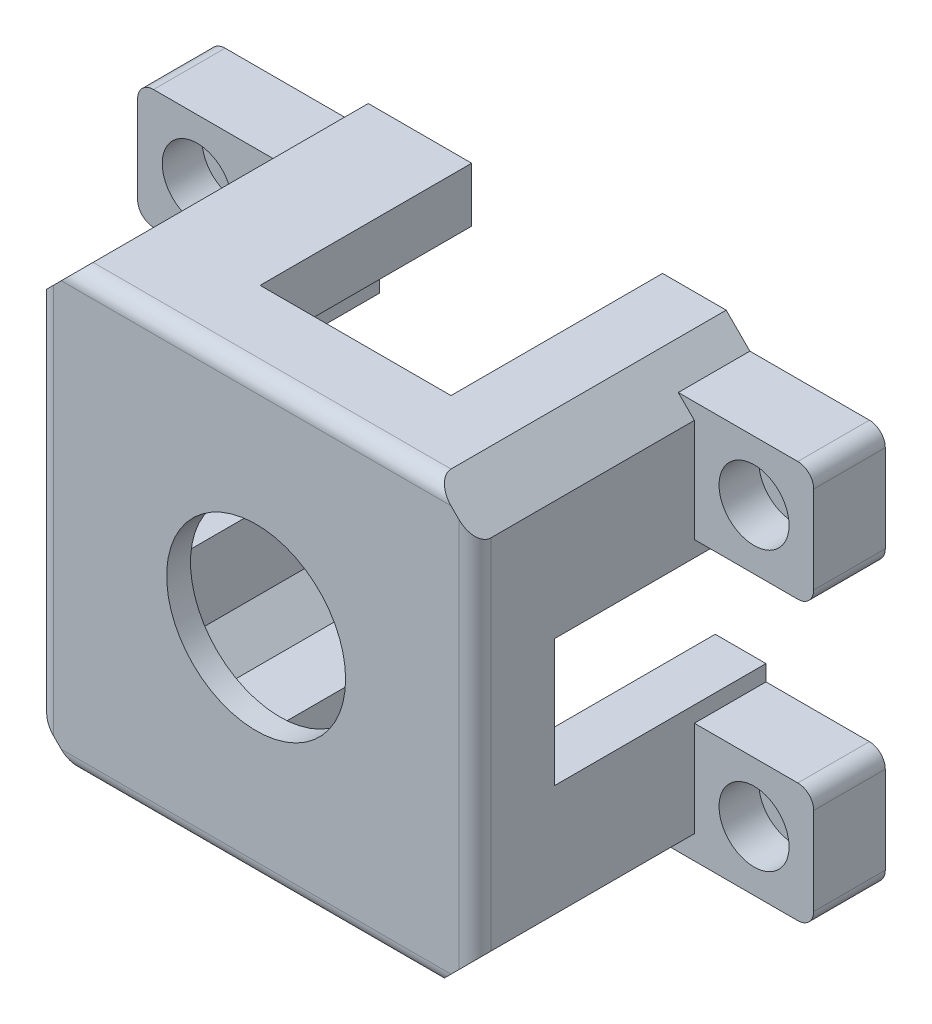
from build123d import *

# Parameters (mm, degrees)
SKETCH2_W           = 55
SKETCH2_H           = 55
BOSS_EXTRUDE1_DEPTH = 33.6
BOSS_EXTRUDE2_DEPTH = 3
SKETCH4_W           = 15
SKETCH4_H           = 15
SKETCH4_R           = 2.6
BOSS_EXTRUDE3_DEPTH = 9
CUT_EXTRUDE1_START  = -5
SKETCH6_R           = 4.4
SKETCH6_R_2         = 2.6
CUT_EXTRUDE1_DEPTH  = 5
CHAMFER1_SIZE       = 5
FILLET4_R           = 2
SKETCH7_W           = 24
SKETCH7_H           = 26.6
CUT_EXTRUDE2_DEPTH  = 67
SKETCH8_W           = 26.6
SKETCH8_H           = 16
CUT_EXTRUDE3_DEPTH  = 67


with BuildPart() as part:
    # Sketch2 → Boss-Extrude1 (new body)
    with BuildSketch(Plane.XY):
        with Locations((0, 0.476186899)):
            Rectangle(SKETCH2_W, SKETCH2_H)
        Polygon((21.118377871, -17.280631787), (21.118377871, 17.280631787), (17.280631787, 21.118377871), (-17.280631787, 21.118377871), (-21.118377871, 17.280631787), (-21.118377871, -17.280631787), (-17.280631787, -21.118377871), (17.280631787, -21.118377871), align=None, mode=Mode.SUBTRACT)
    extrude(amount=BOSS_EXTRUDE1_DEPTH)

    # Sketch3 → Boss-Extrude2 (add)
    with BuildSketch(Plane.XY.offset(33.6)):
        with BuildLine():
            Line((-7.954951288, 8.431138187), (-18.961411379, 19.437598278))
            Line((-18.961411379, 19.437598278), (-21.118377871, 17.280631787))
            Line((-21.118377871, 17.280631787), (-21.118377871, -17.280631787))
            Line((-21.118377871, -17.280631787), (-19.437598278, -18.961411379))
            Line((-19.437598278, -18.961411379), (-7.954951288, -7.478764389))
            ThreePointArc((-7.954951288, -7.478764389), (-11.25, 0.476186899), (-7.954951288, 8.431138187))
        make_face()
        with BuildLine():
            Line((-7.954951288, -7.478764389), (-19.437598278, -18.961411379))
            Line((-19.437598278, -18.961411379), (-17.280631787, -21.118377871))
            Line((-17.280631787, -21.118377871), (17.280631787, -21.118377871))
            Line((17.280631787, -21.118377871), (19.437598278, -18.961411379))
            Line((19.437598278, -18.961411379), (7.954951288, -7.478764389))
            ThreePointArc((7.954951288, -7.478764389), (0, -10.773813101), (-7.954951288, -7.478764389))
        make_face()
        with BuildLine():
            Line((21.118377871, 17.280631787), (18.961411379, 19.437598278))
            Line((18.961411379, 19.437598278), (7.954951288, 8.431138187))
            ThreePointArc((7.954951288, 8.431138187), (10.393644741, 4.781375513), (11.25, 0.476186899))
            ThreePointArc((11.25, 0.476186899), (10.393644741, -3.829001715), (7.954951288, -7.478764389))
            Line((7.954951288, -7.478764389), (19.437598278, -18.961411379))
            Line((19.437598278, -18.961411379), (21.118377871, -17.280631787))
            Line((21.118377871, -17.280631787), (21.118377871, 17.280631787))
        make_face()
        with BuildLine():
            Line((-17.280631787, 21.118377871), (-18.961411379, 19.437598278))
            Line((-18.961411379, 19.437598278), (-7.954951288, 8.431138187))
            ThreePointArc((-7.954951288, 8.431138187), (0, 11.726186899), (7.954951288, 8.431138187))
            Line((7.954951288, 8.431138187), (18.961411379, 19.437598278))
            Line((18.961411379, 19.437598278), (17.280631787, 21.118377871))
            Line((17.280631787, 21.118377871), (-17.280631787, 21.118377871))
        make_face()
        Polygon((-18.961411379, 19.437598278), (-27.5, 27.976186899), (-27.5, -27.023813101), (-19.437598278, -18.961411379), (-21.118377871, -17.280631787), (-21.118377871, 17.280631787), align=None)
        Polygon((-19.437598278, -18.961411379), (-27.5, -27.023813101), (27.5, -27.023813101), (19.437598278, -18.961411379), (17.280631787, -21.118377871), (-17.280631787, -21.118377871), align=None)
        Polygon((27.5, -27.023813101), (27.5, 27.976186899), (18.961411379, 19.437598278), (21.118377871, 17.280631787), (21.118377871, -17.280631787), (19.437598278, -18.961411379), align=None)
        Polygon((27.5, 27.976186899), (-27.5, 27.976186899), (-18.961411379, 19.437598278), (-17.280631787, 21.118377871), (17.280631787, 21.118377871), (18.961411379, 19.437598278), align=None)
    extrude(amount=BOSS_EXTRUDE2_DEPTH)

    # Sketch4 → Boss-Extrude3 (add)
    # profile 1 of 4: a face of its own
    with BuildSketch(Plane(origin=(0, 0, 0), x_dir=(-1, 0, 0), z_dir=(0, 0, -1))):
        with Locations((-35, 17.5)):
            Rectangle(SKETCH4_W, SKETCH4_H)
        with Locations((-35, 17.5)):
            Circle(SKETCH4_R, mode=Mode.SUBTRACT)
    # profile 2 of 4: a face of its own
    with BuildSketch(Plane(origin=(0, 0, 0), x_dir=(-1, 0, 0), z_dir=(0, 0, -1))):
        with Locations((35, 17.5)):
            Rectangle(SKETCH4_W, SKETCH4_H)
        with Locations((35, 17.5)):
            Circle(SKETCH4_R, mode=Mode.SUBTRACT)
    # profile 3 of 4: a face of its own
    with BuildSketch(Plane(origin=(0, 0, 0), x_dir=(-1, 0, 0), z_dir=(0, 0, -1))):
        with Locations((-35, -17.5)):
            Rectangle(SKETCH4_W, SKETCH4_H)
        with Locations((-35, -17.5)):
            Circle(SKETCH4_R, mode=Mode.SUBTRACT)
    # profile 4 of 4: a face of its own
    with BuildSketch(Plane(origin=(0, 0, 0), x_dir=(-1, 0, 0), z_dir=(0, 0, -1))):
        with Locations((17.5, -34.523813101)):
            Rectangle(SKETCH4_W, SKETCH4_H)
        with Locations((17.5, -34.523813101)):
            Circle(SKETCH4_R, mode=Mode.SUBTRACT)
    extrude(amount=-BOSS_EXTRUDE3_DEPTH)

    # Sketch6 → Cut-Extrude1 (cut)
    # profile 1 of 4: a face of its own
    with BuildSketch(Plane.XY.offset(9).offset(CUT_EXTRUDE1_START)):
        with Locations((-17.5, -34.523813101)):
            Circle(SKETCH6_R)
    # profile 2 of 4: a face of its own
    with BuildSketch(Plane.XY.offset(9).offset(CUT_EXTRUDE1_START)):
        with Locations((-35, 17.5)):
            Circle(SKETCH6_R)
    # profile 3 of 4: a face of its own
    with BuildSketch(Plane.XY.offset(9).offset(CUT_EXTRUDE1_START)):
        with Locations((35, -17.5)):
            Circle(SKETCH6_R)
        with Locations(Location((35, -17.5, 0), (0, 0, 180))):
            Circle(SKETCH6_R_2, mode=Mode.SUBTRACT)
    # profile 4 of 4: a face of its own
    with BuildSketch(Plane.XY.offset(9).offset(CUT_EXTRUDE1_START)):
        with Locations((35, 17.5)):
            Circle(SKETCH6_R)
    extrude(amount=CUT_EXTRUDE1_DEPTH, mode=Mode.SUBTRACT)

    # Chamfer1
    chamfer1_edges = [part.edges().sort_by_distance(p)[0] for p in [
        (27.5, -27.023813101, 18.3),
        (-27.5, -27.023813101, 18.3),
        (27.5, 27.976186899, 18.3),
        (-27.5, 27.976186899, 18.3),
    ]]
    chamfer(chamfer1_edges, length=CHAMFER1_SIZE)

    # Fillet4
    fillet4_edges = [part.edges().sort_by_distance(p)[0] for p in [
        (0, 27.976186899, 36.6),
        (27.5, 0.476186899, 36.6),
        (0, -27.023813101, 36.6),
        (-27.5, 0.476186899, 36.6),
        (-25, -42.023813101, 4.5),
        (-10, -42.023813101, 4.5),
        (-42.5, 10, 4.5),
        (-42.5, 25, 4.5),
        (42.5, -25, 4.5),
        (42.5, -10, 4.5),
        (42.5, 10, 4.5),
        (42.5, 25, 4.5),
    ]]
    fillet(fillet4_edges, radius=FILLET4_R)

    # Sketch7 → Cut-Extrude2 (cut)
    with BuildSketch(Plane.XZ.offset(27.023813101)):
        with Locations((2.5, 13.3)):
            Rectangle(SKETCH7_W, SKETCH7_H)
    extrude(amount=-CUT_EXTRUDE2_DEPTH, mode=Mode.SUBTRACT)

    # Sketch8 → Cut-Extrude3 (cut)
    with BuildSketch(Plane.ZY.offset(27.5)):
        with Locations((13.3, 0)):
            Rectangle(SKETCH8_W, SKETCH8_H)
    extrude(amount=-CUT_EXTRUDE3_DEPTH, mode=Mode.SUBTRACT)


solid = part.part
